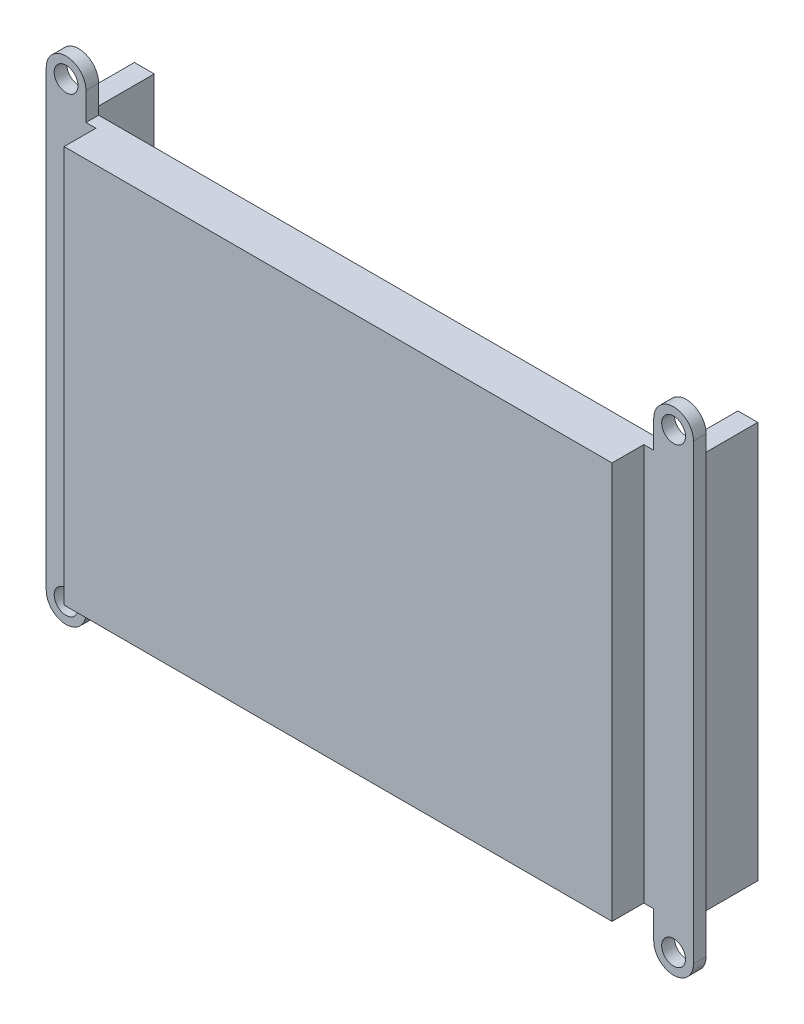
from build123d import *

# Parameters (mm, degrees)
SKETCH1_W             = 69
SKETCH1_H             = 50
BOSS_EXTRUDE1_DEPTH   = 4
SKETCH2_W             = 81.5
SKETCH2_H             = 50
BOSS_EXTRUDE2_DEPTH   = 1.6
SKETCH4_R             = 1.5
BOSS_EXTRUDE3_DEPTH   = 1.6
BOSS_EXTRUDE3_2_DEPTH = 1.6
BOSS_EXTRUDE3_3_DEPTH = 1.6
BOSS_EXTRUDE3_4_DEPTH = 1.6
SKETCH5_W             = 2.5
SKETCH5_H             = 50
BOSS_EXTRUDE4_DEPTH   = 8


with BuildPart() as part:
    # Sketch1 → Boss-Extrude1 (new body)
    with BuildSketch(Plane.XY):
        Rectangle(SKETCH1_W, SKETCH1_H)
    extrude(amount=BOSS_EXTRUDE1_DEPTH)

    # Sketch2 → Boss-Extrude2 (add)
    with BuildSketch(Plane(origin=(0, 0, 0), x_dir=(-1, 0, 0), z_dir=(0, 0, -1))):
        Rectangle(SKETCH2_W, SKETCH2_H)
    extrude(amount=BOSS_EXTRUDE2_DEPTH)



with BuildPart() as body_2:
    # Sketch4 → Boss-Extrude3 (new body)
    with BuildSketch(Plane.XY):
        with BuildLine():
            Line((-40.75, 28.5), (-40.75, 25))
            Line((-40.75, 25), (-35.75, 25))
            Line((-35.75, 25), (-35.75, 28.5))
            ThreePointArc((-35.75, 28.5), (-38.25, 31), (-40.75, 28.5))
        make_face()
        with Locations((-38.25, 28.5)):
            Circle(SKETCH4_R, mode=Mode.SUBTRACT)
    extrude(amount=-BOSS_EXTRUDE3_DEPTH)


with BuildPart() as body_3:
    # Sketch4 → Boss-Extrude3 2 (new body)
    with BuildSketch(Plane.XY):
        with BuildLine():
            Line((-35.75, -25), (-35.75, -28.5))
            ThreePointArc((-35.75, -28.5), (-38.25, -31), (-40.75, -28.5))
            Line((-40.75, -28.5), (-40.75, -25))
            Line((-40.75, -25), (-35.75, -25))
        make_face()
        with Locations((-38.25, -28.5)):
            Circle(SKETCH4_R, mode=Mode.SUBTRACT)
    extrude(amount=-BOSS_EXTRUDE3_2_DEPTH)


with BuildPart() as body_4:
    # Sketch4 → Boss-Extrude3 3 (new body)
    with BuildSketch(Plane.XY):
        with BuildLine():
            Line((40.75, -28.5), (40.75, -25))
            Line((40.75, -25), (35.75, -25))
            Line((35.75, -25), (35.75, -28.5))
            ThreePointArc((35.75, -28.5), (38.25, -31), (40.75, -28.5))
        make_face()
        with Locations((38.25, -28.5)):
            Circle(SKETCH4_R, mode=Mode.SUBTRACT)
    extrude(amount=-BOSS_EXTRUDE3_3_DEPTH)


with BuildPart() as body_5:
    # Sketch4 → Boss-Extrude3 4 (new body)
    with BuildSketch(Plane.XY):
        with BuildLine():
            Line((35.75, 25), (35.75, 28.5))
            ThreePointArc((35.75, 28.5), (38.25, 31), (40.75, 28.5))
            Line((40.75, 28.5), (40.75, 25))
            Line((40.75, 25), (35.75, 25))
        make_face()
        with Locations((38.25, 28.5)):
            Circle(SKETCH4_R, mode=Mode.SUBTRACT)
    extrude(amount=-BOSS_EXTRUDE3_4_DEPTH)


with BuildPart() as part_1:
    add(part.part)

    add(body_2.part)  # Boss-Extrude4 merges body 2

    add(body_3.part)  # Boss-Extrude4 merges body 3

    add(body_4.part)  # Boss-Extrude4 merges body 4

    add(body_5.part)  # Boss-Extrude4 merges body 5
    # Sketch5 → Boss-Extrude4 (add)
    with BuildSketch(Plane(origin=(0, 0, -1.6), x_dir=(-1, 0, 0), z_dir=(0, 0, -1))):
        with Locations((-38, 0)):
            Rectangle(SKETCH5_W, SKETCH5_H)
        with Locations((38, 0)):
            Rectangle(SKETCH5_W, SKETCH5_H)
    extrude(amount=BOSS_EXTRUDE4_DEPTH)


solid = part_1.part
